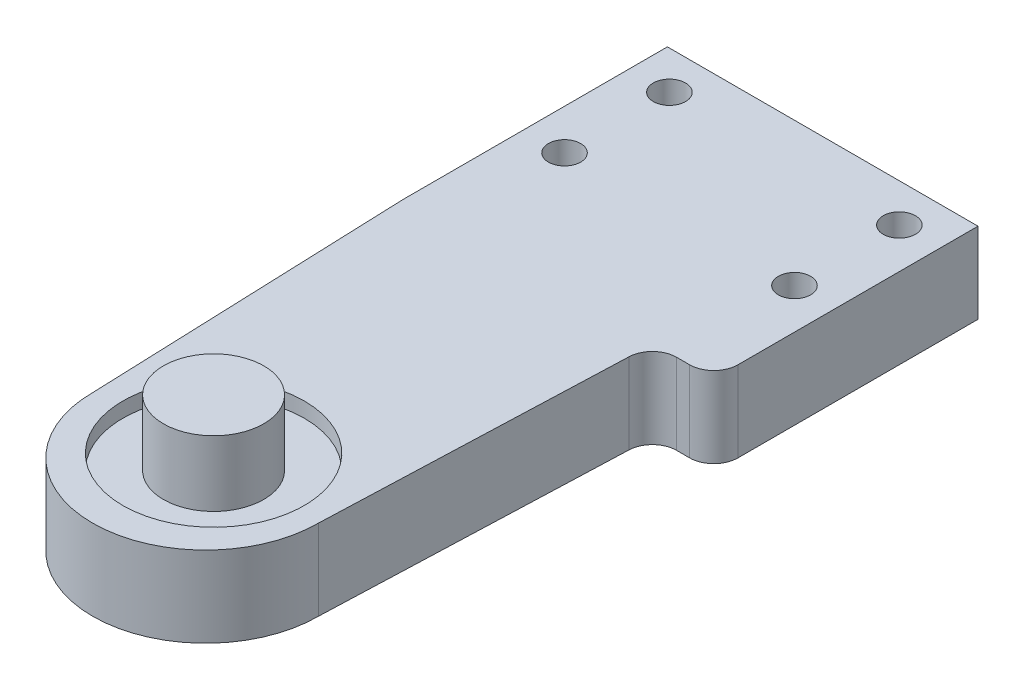
from build123d import *

# Parameters (mm, degrees)
SKETCH1_W             = 38.5
SKETCH1_H             = 22.75
BOSS_EXTRUDE1_DEPTH   = 10
F_4_0MM_DOWEL_HOLE1_D = 4
BOSS_EXTRUDE2_DEPTH   = 10
SKETCH5_R             = 11.2395
CUT_EXTRUDE1_DEPTH    = 1.8542
SKETCH6_R             = 6.223
BOSS_EXTRUDE3_DEPTH   = 8.128


with BuildPart() as part:
    # Sketch1 → Boss-Extrude1 (new body)
    with BuildSketch(Plane(origin=(0, 0, 0), x_dir=(1, 0, 0), z_dir=(0, 1, 0))):
        with Locations((0, -0.125)):
            Rectangle(SKETCH1_W, SKETCH1_H)
    extrude(amount=BOSS_EXTRUDE1_DEPTH)

    # Ø4.0mm Dowel Hole1 (through all)
    with Locations(Plane(origin=(0, 10, 0), x_dir=(1, 0, 0), z_dir=(0, 1, 0))):
        with Locations((14.25, 6.5), (-14.25, -6.5), (-14.25, 6.5), (14.25, -6.5)):
            Hole(F_4_0MM_DOWEL_HOLE1_D / 2)

    # Sketch4 → Boss-Extrude2 (add)
    with BuildSketch(Plane.XZ.offset(-10)):
        with BuildLine():
            Line((-19.25, 21.5), (-19.25, 11.5))
            Line((-19.25, 11.5), (19.25, 11.5))
            Line((19.25, 11.5), (19.25, 18.5))
            ThreePointArc((19.25, 18.5), (18.371320344, 20.621320344), (16.25, 21.5))
            Line((16.25, 21.5), (14.639608634, 21.5))
            ThreePointArc((14.639608634, 21.5), (12.558414619, 22.339298384), (11.641715787, 24.387579018))
            Line((11.641715787, 24.387579018), (10.25, 61.5))
            ThreePointArc((10.25, 61.5), (-3.75, 75.5), (-17.75, 61.5))
            Line((-17.75, 61.5), (-19.25, 21.5))
        make_face()
    extrude(amount=BOSS_EXTRUDE2_DEPTH)

    # Sketch5 → Cut-Extrude1 (cut)
    with BuildSketch(Plane(origin=(0, 10, 0), x_dir=(1, 0, 0), z_dir=(0, 1, 0))):
        with Locations(Location((-3.75, -60.5, 0), (0, 0, 270))):
            Circle(SKETCH5_R)
    extrude(amount=-CUT_EXTRUDE1_DEPTH, mode=Mode.SUBTRACT)

    # Sketch6 → Boss-Extrude3 (add)
    with BuildSketch(Plane(origin=(0, 8.1458, 0), x_dir=(1, 0, 0), z_dir=(0, 1, 0))):
        with Locations(Location((-3.75, -60.5, 0), (0, 0, 270))):
            Circle(SKETCH6_R)
    extrude(amount=BOSS_EXTRUDE3_DEPTH)


solid = part.part
